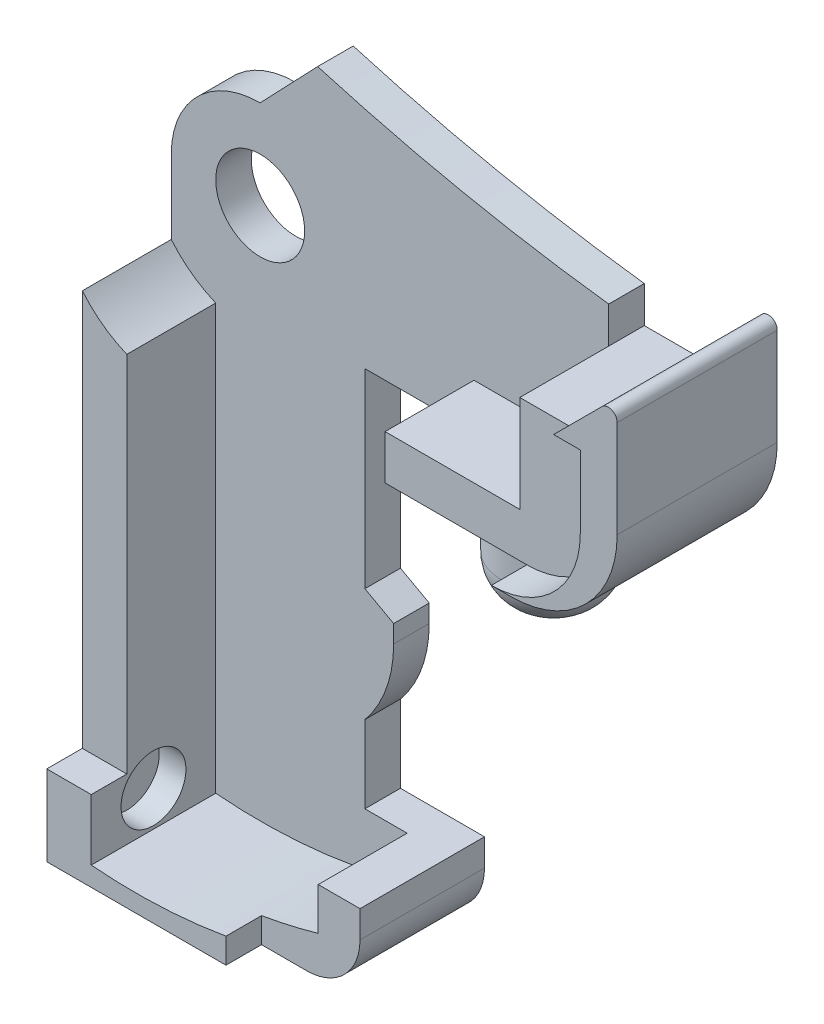
from build123d import *

# Parameters (mm, degrees)
EXTRUDE_3_DEPTH     = 9
EXTRUDE_3_2_DEPTH   = 9
EXTRUDE_4_DEPTH     = 7
SKETCH_1_8_R        = 2.5
EXTRUDE_5_DEPTH     = 2
SKETCH_2_R          = 2.9
EXTRUDE_6_DEPTH     = 2.45
SKETCH_4_R          = 2.9
EXTRUDE_7_DEPTH     = 2
FILLET_2_R          = 2.4
SKETCH_5_R          = 1.825
CUT_EXTRUDE_1_DEPTH = 1.5


with BuildPart() as part:
    # 스케치1 → 보스-돌출3 (new body)
    with BuildSketch(Plane.XY):
        with BuildLine():
            Line((-2.5, -26.437677825), (-5, -26.437677825))
            Line((-5, -26.437677825), (-5, -30.96175738))
            Line((-5, -30.96175738), (5.076141326, -30.96175738))
            Line((5.076141326, -30.96175738), (5.076141326, -29.54601506))
            ThreePointArc((5.076141326, -29.54601506), (1.298498135, -29.950761581), (-2.5, -29.874474333))
            Line((-2.5, -29.874474333), (-2.5, -26.437677825))
        make_face()
    extrude(amount=EXTRUDE_3_DEPTH)

    # 스케치1<7> → 보스-돌출4 (add)
    with BuildSketch(Plane.XY):
        with BuildLine():
            Line((23.5, 2.950728465), (19.6, 2.950728465))
            Line((19.6, 2.950728465), (19.6, -2.5))
            Line((19.6, -2.5), (12.023157318, -2.5))
            Line((12.023157318, -2.5), (12.023157318, -5))
            Line((12.023157318, -5), (20, -5))
            ThreePointArc((20, -5), (23.535533906, -3.535533906), (25, 0))
            Line((25, 0), (25, 4.09591659))
            Line((25, 4.09591659), (23.5, 4.09591659))
            Line((23.5, 4.09591659), (23.5, 2.950728465))
        make_face()
        with BuildLine():
            ThreePointArc((-2.5, -6), (-3.862002616, -5.228282299), (-5, -4.153311931))
            Line((-5, -4.153311931), (-5, -26.437677825))
            Line((-5, -26.437677825), (-2.5, -26.437677825))
            Line((-2.5, -26.437677825), (-2.5, -6))
        make_face()
        with BuildLine():
            Line((5.076141326, -29.54601506), (5.076141326, -30.96175738))
            Line((5.076141326, -30.96175738), (7.613716386, -30.96175738))
            ThreePointArc((7.613716386, -30.96175738), (9.735036729, -30.083077723), (10.613716386, -27.96175738))
            Line((10.613716386, -27.96175738), (10.613716386, -26.437579436))
            Line((10.613716386, -26.437579436), (8.264928228, -26.437579436))
            Line((8.264928228, -26.437579436), (8.264928228, -28.81709871))
            ThreePointArc((8.264928228, -28.81709871), (6.680483813, -29.225080884), (5.076141326, -29.54601506))
        make_face()
    extrude(amount=EXTRUDE_4_DEPTH)


with BuildPart() as body_2:
    # 스케치1 → Extrude 3 2 (new body)
    with BuildSketch(Plane.XY):
        with BuildLine():
            Line((26.22215467, 6.81807126), (23.5, 4.09591659))
            Line((23.5, 4.09591659), (25, 4.09591659))
            Line((25, 4.09591659), (25, 0))
            ThreePointArc((25, 0), (23.535533906, -3.535533906), (20, -5))
            Line((20, -5), (21.075708061, -5))
            ThreePointArc((21.075708061, -5), (25.318348748, -3.242640687), (27.075708061, 1))
            Line((27.075708061, 1), (27.075708061, 6.46451787))
            ThreePointArc((27.075708061, 6.46451787), (26.767049777, 6.926457636), (26.22215467, 6.81807126))
        make_face()
    extrude(amount=EXTRUDE_3_2_DEPTH)


with BuildPart() as extrude_4_piece_1:
    # of the separate pieces the step leaves, piece 1, a body of its own (extrude_4_pieces)
    add(part.part.solids().sort_by_distance((-2.5, -29.874474333, 0))[0])



with BuildPart() as extrude_4_piece_2:
    # of the separate pieces the step leaves, piece 2, a body of its own (extrude_4_pieces)
    add(part.part.solids().sort_by_distance((23.5, 2.950728465, 0))[0])


with BuildPart() as extrude_4_piece_1_1:
    add(extrude_4_piece_1.part)

    add(extrude_4_piece_2.part)  # 보스-돌출5 merges 보스-돌출4 piece 2
    # 스케치1<8> → 보스-돌출5 (add)
    with BuildSketch(Plane.XY):
        with BuildLine():
            Line((3.231912185, 8.38327913), (0, 5))
            ThreePointArc((0, 5), (-3.535533906, 3.535533906), (-5, 0))
            Line((-5, 0), (-5, -4.153311931))
            ThreePointArc((-5, -4.153311931), (-3.862002616, -5.228282299), (-2.5, -6))
            Line((-2.5, -6), (-2.5, -29.874474333))
            ThreePointArc((-2.5, -29.874474333), (2.93054776, -29.83531643), (8.264928228, -28.81709871))
            Line((8.264928228, -28.81709871), (8.264928228, -26.437579436))
            Line((8.264928228, -26.437579436), (5.889404941, -26.437579436))
            Line((5.889404941, -26.437579436), (5.889404941, -22.090836604))
            ThreePointArc((5.889404941, -22.090836604), (7.089676261, -19.98856225), (7.506209453, -17.603880133))
            Line((7.506209453, -17.603880133), (7.506209453, -16.606122356))
            Line((7.506209453, -16.606122356), (5.889404941, -15.718789718))
            Line((5.889404941, -15.718789718), (5.889404941, -5))
            Line((5.889404941, -5), (12.023157318, -5))
            Line((12.023157318, -5), (12.023157318, -2.5))
            Line((12.023157318, -2.5), (19.6, -2.5))
            Line((19.6, -2.5), (19.6, 5))
            ThreePointArc((19.6, 5), (11.347380216, 6.359873864), (3.231912185, 8.38327913))
        make_face()
        Circle(SKETCH_1_8_R, mode=Mode.SUBTRACT)
    extrude(amount=EXTRUDE_5_DEPTH)

    # 스케치2 → 보스-돌출6 (add, symmetric)
    with BuildSketch(Plane.XZ.offset(5)):
        with Locations((18, 3.5)):
            Circle(SKETCH_2_R)
    extrude(amount=EXTRUDE_6_DEPTH, both=True)

    # 스케치4 → 보스-돌출7 (add)
    with BuildSketch(Plane.XZ.offset(7.45)):
        with Locations((18, 3.5)):
            Circle(SKETCH_4_R)
    extrude(amount=EXTRUDE_7_DEPTH)

    # 필렛2
    fillet_2_edges = [extrude_4_piece_1_1.edges().sort_by_distance(p)[0] for p in [
        (15.1, -9.45, 3.5),
    ]]
    fillet(fillet_2_edges, radius=FILLET_2_R)

    # 스케치5 → 컷-돌출1 (cut)
    with BuildSketch(Plane(origin=(-2.5, 0, 0), x_dir=(0, 0, -1), z_dir=(1, 0, 0))):
        with Locations((-5.5, -27.874474333)):
            Circle(SKETCH_5_R)
    extrude(amount=-CUT_EXTRUDE_1_DEPTH, mode=Mode.SUBTRACT)


solid = Compound([body_2.part, extrude_4_piece_1_1.part])
